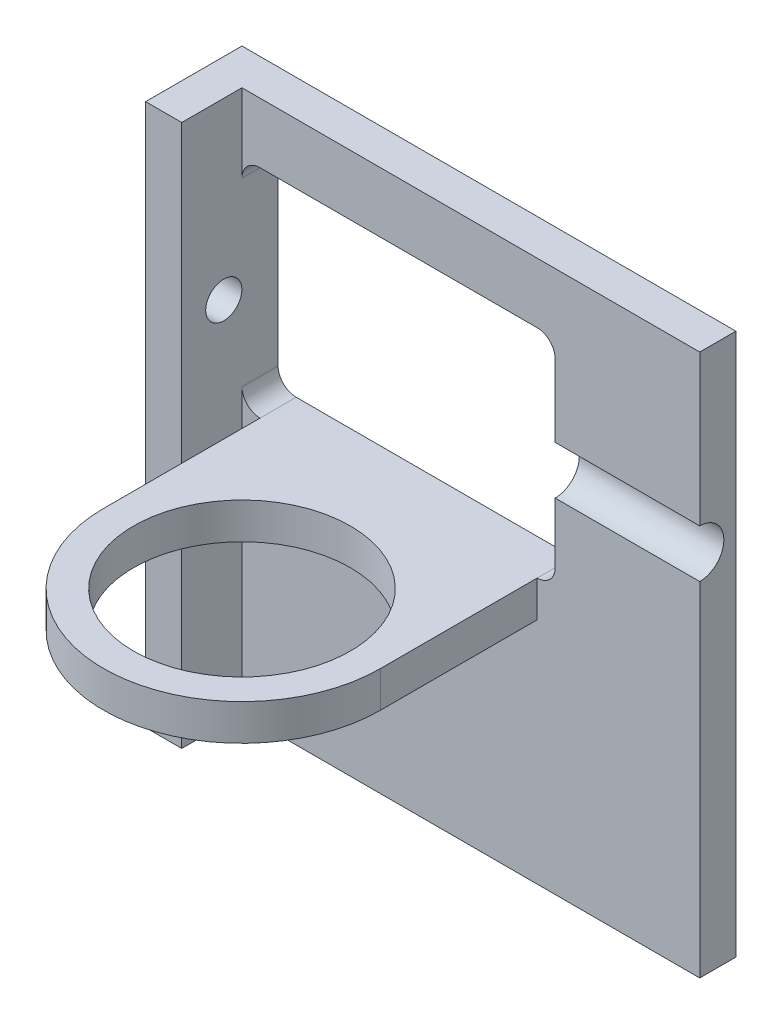
from build123d import *

# Parameters (mm, degrees)
SKETCH1_W           = 41
SKETCH1_H           = 45
BOSS_EXTRUDE1_DEPTH = 3
SKETCH2_W           = 5
SKETCH2_H           = 45
SKETCH2_R           = 1.5
BOSS_EXTRUDE2_DEPTH = 3
SKETCH4_R           = 9
BOSS_EXTRUDE3_DEPTH = 3
CUT_EXTRUDE4_DEPTH  = 12


with BuildPart() as part:
    # Sketch1 → Boss-Extrude1 (new body)
    with BuildSketch(Plane.XY):
        with Locations((20.5, -22.5)):
            Rectangle(SKETCH1_W, SKETCH1_H)
        with BuildLine():
            Line((27.5, -23), (4.5, -23))
            ThreePointArc((4.5, -23), (3.439339828, -22.560660172), (3, -21.5))
            Line((3, -21.5), (3, -6.5))
            ThreePointArc((3, -6.5), (3.439339828, -5.439339828), (4.5, -5))
            Line((4.5, -5), (27.5, -5))
            ThreePointArc((27.5, -5), (28.560660172, -5.439339828), (29, -6.5))
            Line((29, -6.5), (29, -21.5))
            ThreePointArc((29, -21.5), (28.560660172, -22.560660172), (27.5, -23))
        make_face(mode=Mode.SUBTRACT)
    extrude(amount=BOSS_EXTRUDE1_DEPTH)

    # Sketch2 → Boss-Extrude2 (add)
    with BuildSketch(Plane(origin=(0, 0, 0), x_dir=(0, 0, -1), z_dir=(1, 0, 0))):
        with Locations((-5.5, -22.5)):
            Rectangle(SKETCH2_W, SKETCH2_H)
        with Locations((-4.51, -14.5)):
            Circle(SKETCH2_R, mode=Mode.SUBTRACT)
    extrude(amount=BOSS_EXTRUDE2_DEPTH)

    # Sketch4 → Boss-Extrude3 (add)
    with BuildSketch(Plane(origin=(0, -23, 0), x_dir=(1, 0, 0), z_dir=(0, 1, 0))):
        with BuildLine():
            Line((4.5, -3), (4.5, -16))
            ThreePointArc((4.5, -16), (16, -27.5), (27.5, -16))
            Line((27.5, -16), (27.5, -3))
            Line((27.5, -3), (4.5, -3))
        make_face()
        with Locations(Location((16, -16, 0), (0, 0, 270))):
            Circle(SKETCH4_R, mode=Mode.SUBTRACT)
    extrude(amount=-BOSS_EXTRUDE3_DEPTH)

    # Sketch7 → Cut-Extrude4 (cut)
    with BuildSketch(Plane(origin=(41, 0, 0), x_dir=(0, 0, -1), z_dir=(1, 0, 0))):
        with BuildLine():
            Line((-3, -12.5), (-3, -16.5))
            ThreePointArc((-3, -16.5), (-1, -14.5), (-3, -12.5))
        make_face()
    extrude(amount=-CUT_EXTRUDE4_DEPTH, mode=Mode.SUBTRACT)


solid = part.part
